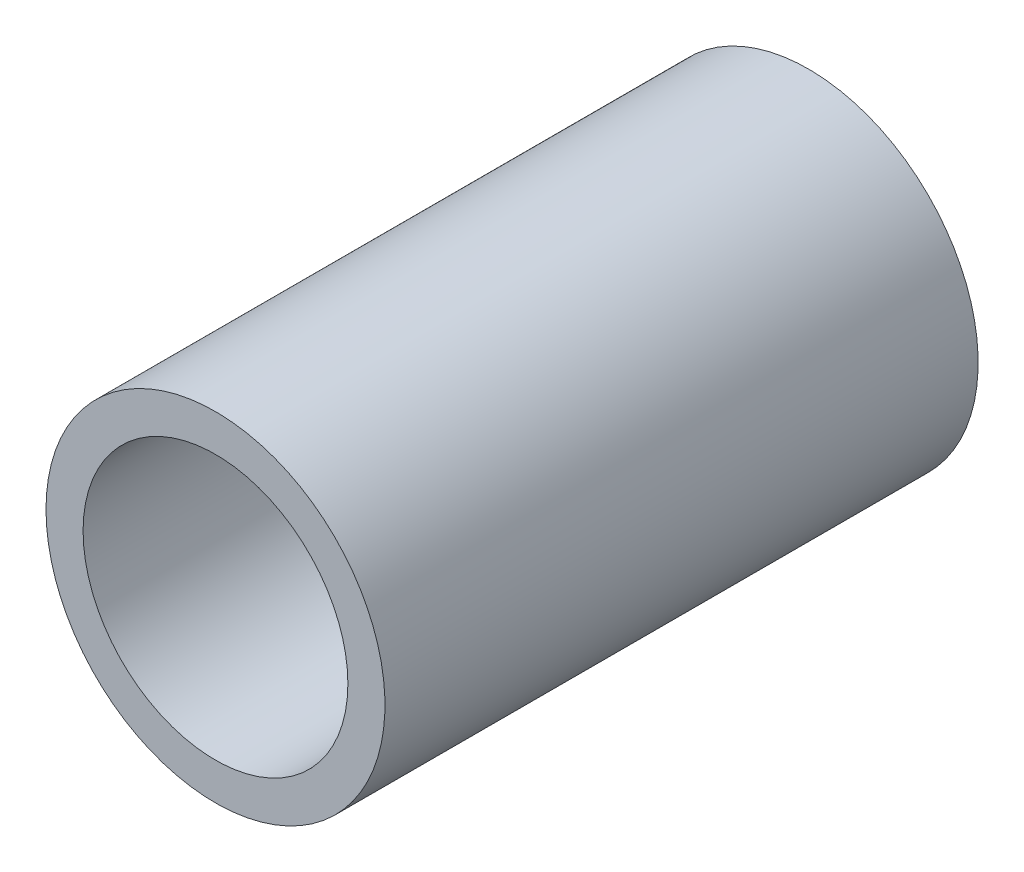
from build123d import *

# Parameters (mm, degrees)
SKETCH1_R           = 8
SKETCH1_R_2         = 6.25
BOSS_EXTRUDE1_DEPTH = 28


with BuildPart() as part:
    # Sketch1 → Boss-Extrude1 (new body)
    with BuildSketch(Plane.XY):
        with Locations(Location((0, 0, 0), (0, 0, 180))):
            Circle(SKETCH1_R)
        with Locations(Location((0, 0, 0), (0, 0, 180))):
            Circle(SKETCH1_R_2, mode=Mode.SUBTRACT)
    extrude(amount=BOSS_EXTRUDE1_DEPTH)


solid = part.part
